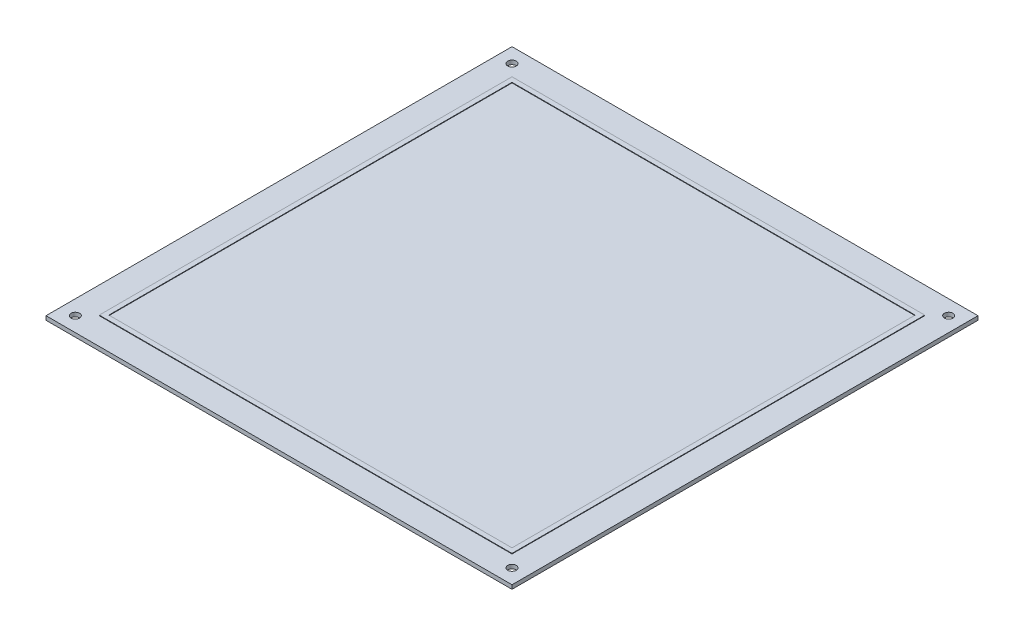
from build123d import *

# Parameters (mm, degrees)
SKETCH1_W                                      = 350
SKETCH1_H                                      = 350
SKETCH1_R                                      = 3.2
BASE_PLATE_STRUCTURAL_PANEL_DEPTH              = 1.5
SKETCH2_W                                      = 310
SKETCH2_H                                      = 310
SKETCH2_W_2                                    = 302.8
SKETCH2_H_2                                    = 302.8
BASE_PLATE_STRUCTURAL_PANEL_INSET_STIFFE_DEPTH = 1.9


with BuildPart() as part:
    # Sketch1 → Base plate structural panel (new, symmetric)
    with BuildSketch(Plane(origin=(0, 0, 0), x_dir=(1, 0, 0), z_dir=(0, 1, 0))):
        Rectangle(SKETCH1_W, SKETCH1_H)
        with Locations(Location((164, 164, 0), (0, 0, 270))):
            Circle(SKETCH1_R, mode=Mode.SUBTRACT)
        with Locations(Location((-164, 164, 0), (0, 0, 270))):
            Circle(SKETCH1_R, mode=Mode.SUBTRACT)
        with Locations(Location((164, -164, 0), (0, 0, 270))):
            Circle(SKETCH1_R, mode=Mode.SUBTRACT)
        with Locations(Location((-164, -164, 0), (0, 0, 270))):
            Circle(SKETCH1_R, mode=Mode.SUBTRACT)
    extrude(amount=BASE_PLATE_STRUCTURAL_PANEL_DEPTH, both=True)

    # Sketch2 → Base plate structural panel inset stiffener (add, symmetric)
    with BuildSketch(Plane(origin=(0, 0, 0), x_dir=(1, 0, 0), z_dir=(0, 1, 0))):
        Rectangle(SKETCH2_W, SKETCH2_H)
        Rectangle(SKETCH2_W_2, SKETCH2_H_2, mode=Mode.SUBTRACT)
    extrude(amount=BASE_PLATE_STRUCTURAL_PANEL_INSET_STIFFE_DEPTH, both=True)


solid = part.part
